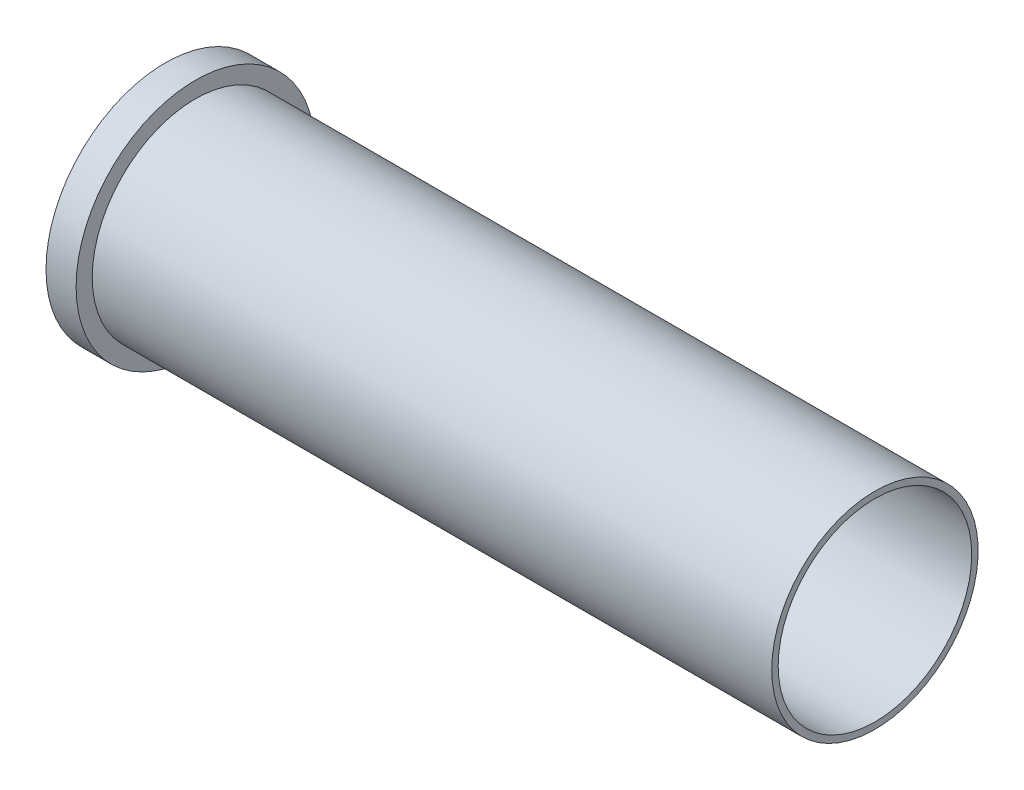
from build123d import *


with BuildPart() as part:
    # Esboço1 → Revolução1 (revolve)
    with BuildSketch(Plane(origin=(0, 0, 0), x_dir=(1, 0, 0), z_dir=(0, 1, 0)), mode=Mode.PRIVATE) as revolu_o1_sk:
        Polygon((3.8, 1.05), (2.960398706, 1.05), (2.960398706, 2.25), (0, 2.25), (0, 5.55), (1.4, 5.55), (1.4, 4.8), (33, 4.8), (33, 4.5), (3.8, 4.5), align=None)
    revolve(revolu_o1_sk.sketch.rotate(Axis((0, 0, 0), (1, 0, 0)), 180), axis=Axis((0, 0, 0), (1, 0, 0)))


solid = part.part
